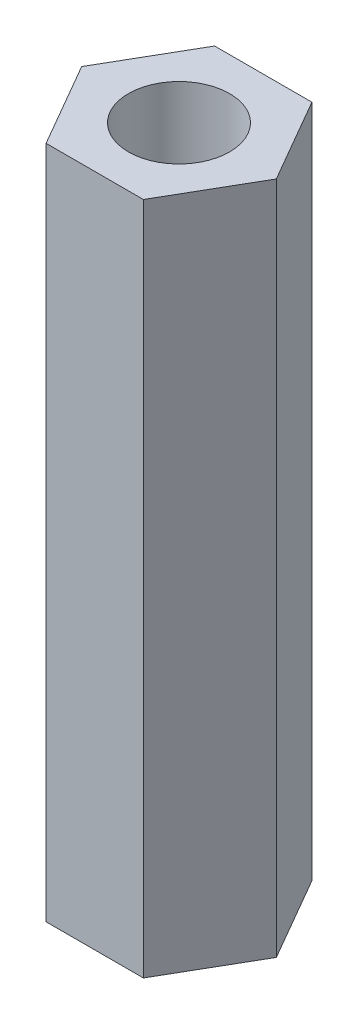
from build123d import *

# Parameters (mm, degrees)
SKETCH1_R           = 1.5
BOSS_EXTRUDE1_DEPTH = 20


with BuildPart() as part:
    # Sketch1 → Boss-Extrude1 (new body)
    with BuildSketch(Plane(origin=(0, 0, 0), x_dir=(1, 0, 0), z_dir=(0, 1, 0))):
        Polygon((1.443375673, 2.5), (-1.443375673, 2.5), (-2.886751346, 0), (-1.443375673, -2.5), (1.443375673, -2.5), (2.886751346, 0), align=None)
        with Locations(Location((0, 0, 0), (0, 0, 270))):
            Circle(SKETCH1_R, mode=Mode.SUBTRACT)
    extrude(amount=BOSS_EXTRUDE1_DEPTH)


solid = part.part
